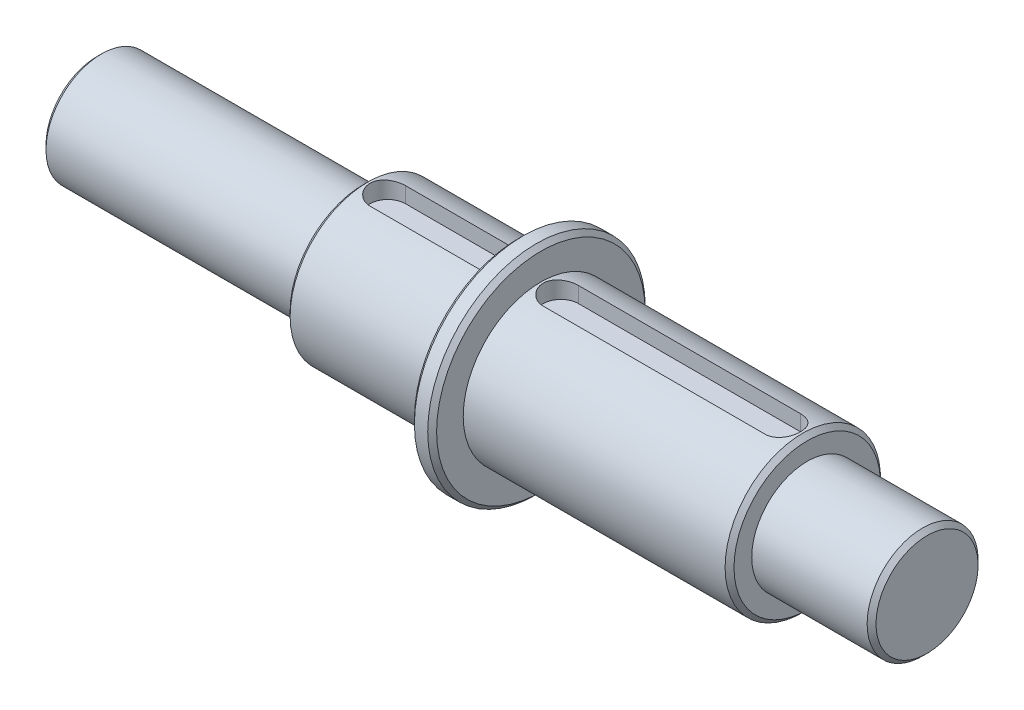
from build123d import *

# Parameters (mm, degrees)
CUT_EXTRUDE1_DEPTH = 4
CUT_EXTRUDE2_DEPTH = 4


with BuildPart() as part:
    # Sketch1 → Revolve1 (revolve)
    with BuildSketch(Plane.XY, mode=Mode.PRIVATE) as revolve1_sk:
        Polygon((-94.195536663, 0), (-94.195536663, 11.5), (-93.195536663, 12.5), (-34.195536663, 12.5), (-34.195536663, 16.5), (-33.195536663, 17.5), (0.804463337, 17.5), (0.804463337, 23.5), (1.804463337, 24.5), (4.804463337, 24.5), (5.804463337, 23.5), (5.804463337, 17.5), (64.804463337, 17.5), (65.804463337, 16.5), (65.804463337, 12.5), (91.804463337, 12.5), (92.804463337, 11.5), (92.804463337, 0), align=None)
    revolve(revolve1_sk.sketch.rotate(Axis((-126.190223167, 0, 0), (1, 0, 0)), 90), axis=Axis((-126.190223167, 0, 0), (1, 0, 0)))

    # Sketch2 → Cut-Extrude1 (cut)
    with BuildSketch(Plane(origin=(0, 17.5, 0), x_dir=(1, 0, 0), z_dir=(0, 1, 0))):
        with BuildLine():
            Line((-28.695536663, 4), (-3.695536663, 4))
            ThreePointArc((-3.695536663, 4), (0.304463337, 0), (-3.695536663, -4))
            Line((-3.695536663, -4), (-28.695536663, -4))
            ThreePointArc((-28.695536663, -4), (-32.695536663, 0), (-28.695536663, 4))
        make_face()
    extrude(amount=-CUT_EXTRUDE1_DEPTH, mode=Mode.SUBTRACT)

    # Sketch3 → Cut-Extrude2 (cut)
    with BuildSketch(Plane(origin=(0, 17.5, 0), x_dir=(1, 0, 0), z_dir=(0, 1, 0))):
        with BuildLine():
            Line((10.304463337, 4), (60.304463337, 4))
            ThreePointArc((60.304463337, 4), (64.304463337, 0), (60.304463337, -4))
            Line((60.304463337, -4), (10.304463337, -4))
            ThreePointArc((10.304463337, -4), (6.304463337, 0), (10.304463337, 4))
        make_face()
    extrude(amount=-CUT_EXTRUDE2_DEPTH, mode=Mode.SUBTRACT)


solid = part.part
